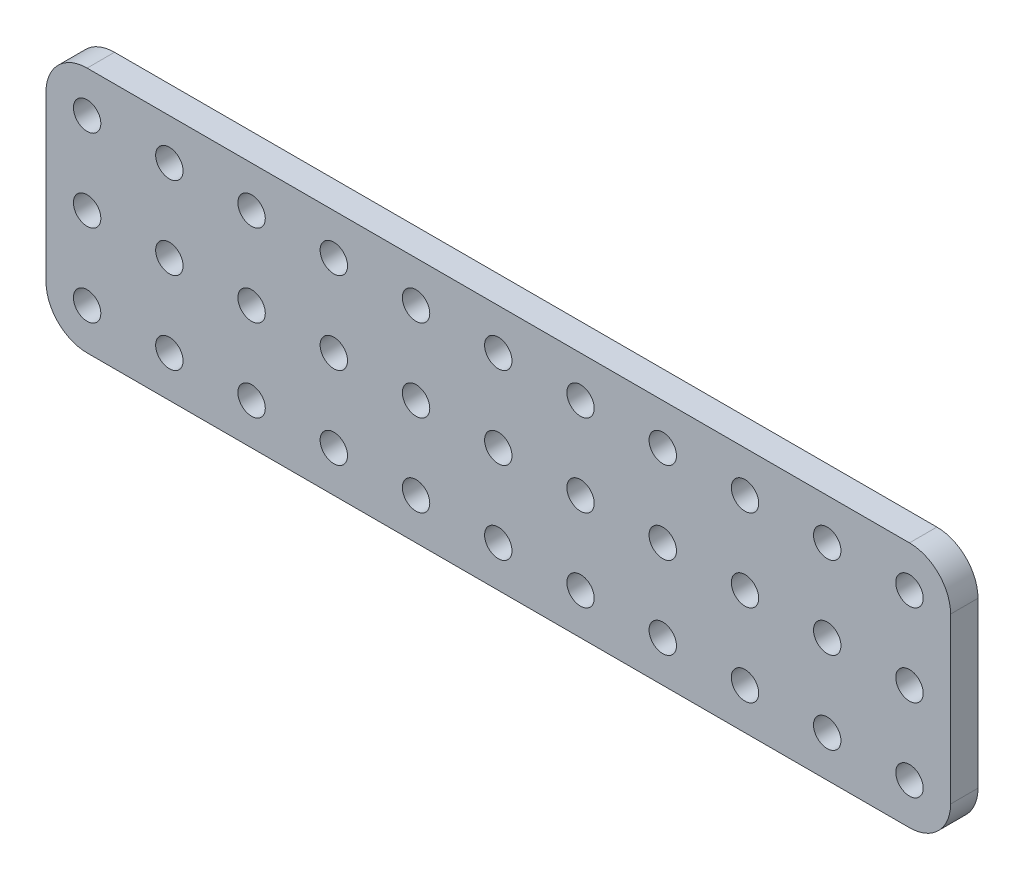
from build123d import *

# Parameters (mm, degrees)
MODEL_R                 = 1.5
SALIENTE_EXTRUIR1_DEPTH = 3


with BuildPart() as part:
    # Model → Saliente-Extruir1 (new body)
    with BuildSketch(Plane.XY):
        with BuildLine():
            Line((256.429131311, 237.742243614), (346.429131311, 237.742243614))
            ThreePointArc((346.429131311, 237.742243614), (349.611111826, 236.424224129), (350.929131311, 233.242243614))
            Line((350.929131311, 233.242243614), (350.929131311, 215.242243614))
            ThreePointArc((350.929131311, 215.242243614), (349.611111826, 212.060263099), (346.429131311, 210.742243614))
            Line((346.429131311, 210.742243614), (256.429131311, 210.742243614))
            ThreePointArc((256.429131311, 210.742243614), (253.247150795, 212.060263099), (251.929131311, 215.242243614))
            Line((251.929131311, 215.242243614), (251.929131311, 233.242243614))
            ThreePointArc((251.929131311, 233.242243614), (253.247150795, 236.424224129), (256.429131311, 237.742243614))
        make_face()
        with Locations((310.429131311, 233.242243614)):
            Circle(MODEL_R, mode=Mode.SUBTRACT)
        with Locations((292.429131311, 233.242243614)):
            Circle(MODEL_R, mode=Mode.SUBTRACT)
        with Locations((301.429131311, 233.242243614)):
            Circle(MODEL_R, mode=Mode.SUBTRACT)
        with Locations((337.429131311, 215.242243614)):
            Circle(MODEL_R, mode=Mode.SUBTRACT)
        with Locations((319.429131311, 215.242243614)):
            Circle(MODEL_R, mode=Mode.SUBTRACT)
        with Locations((328.429131311, 215.242243614)):
            Circle(MODEL_R, mode=Mode.SUBTRACT)
        with Locations((310.429131311, 215.242243614)):
            Circle(MODEL_R, mode=Mode.SUBTRACT)
        with Locations((292.429131311, 215.242243614)):
            Circle(MODEL_R, mode=Mode.SUBTRACT)
        with Locations((301.429131311, 215.242243614)):
            Circle(MODEL_R, mode=Mode.SUBTRACT)
        with Locations((274.429131311, 215.242243614)):
            Circle(MODEL_R, mode=Mode.SUBTRACT)
        with Locations((283.429131311, 215.242243614)):
            Circle(MODEL_R, mode=Mode.SUBTRACT)
        with Locations((265.429131311, 215.242243614)):
            Circle(MODEL_R, mode=Mode.SUBTRACT)
        with Locations((256.429131311, 215.242243614)):
            Circle(MODEL_R, mode=Mode.SUBTRACT)
        with Locations((346.429131311, 215.242243614)):
            Circle(MODEL_R, mode=Mode.SUBTRACT)
        with Locations((274.429131311, 233.242243614)):
            Circle(MODEL_R, mode=Mode.SUBTRACT)
        with Locations((265.429131311, 233.242243614)):
            Circle(MODEL_R, mode=Mode.SUBTRACT)
        with Locations((256.429131311, 233.242243614)):
            Circle(MODEL_R, mode=Mode.SUBTRACT)
        with Locations((283.429131311, 233.242243614)):
            Circle(MODEL_R, mode=Mode.SUBTRACT)
        with Locations((337.429131311, 233.242243614)):
            Circle(MODEL_R, mode=Mode.SUBTRACT)
        with Locations((319.429131311, 233.242243614)):
            Circle(MODEL_R, mode=Mode.SUBTRACT)
        with Locations((328.429131311, 233.242243614)):
            Circle(MODEL_R, mode=Mode.SUBTRACT)
        with Locations((346.429131311, 233.242243614)):
            Circle(MODEL_R, mode=Mode.SUBTRACT)
        with Locations((337.429131311, 224.242243614)):
            Circle(MODEL_R, mode=Mode.SUBTRACT)
        with Locations((319.429131311, 224.242243614)):
            Circle(MODEL_R, mode=Mode.SUBTRACT)
        with Locations((328.429131311, 224.242243614)):
            Circle(MODEL_R, mode=Mode.SUBTRACT)
        with Locations((310.429131311, 224.242243614)):
            Circle(MODEL_R, mode=Mode.SUBTRACT)
        with Locations((292.429131311, 224.242243614)):
            Circle(MODEL_R, mode=Mode.SUBTRACT)
        with Locations((301.429131311, 224.242243614)):
            Circle(MODEL_R, mode=Mode.SUBTRACT)
        with Locations((274.429131311, 224.242243614)):
            Circle(MODEL_R, mode=Mode.SUBTRACT)
        with Locations((283.429131311, 224.242243614)):
            Circle(MODEL_R, mode=Mode.SUBTRACT)
        with Locations((265.429131311, 224.242243614)):
            Circle(MODEL_R, mode=Mode.SUBTRACT)
        with Locations((256.429131311, 224.242243614)):
            Circle(MODEL_R, mode=Mode.SUBTRACT)
        with Locations((346.429131311, 224.242243614)):
            Circle(MODEL_R, mode=Mode.SUBTRACT)
    extrude(amount=SALIENTE_EXTRUIR1_DEPTH)


solid = part.part
